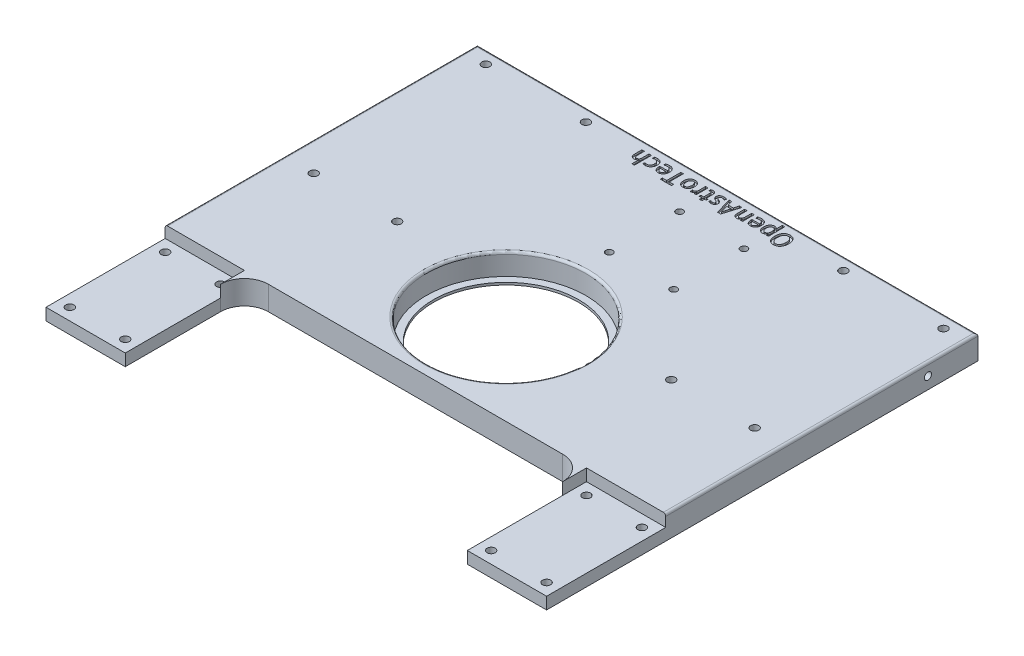
from build123d import *

# Parameters (mm, degrees)
SKIZZE1_W                        = 210
SKIZZE1_H                        = 420
AUFSATZ_LINEAR_AUSTRAGEN1_DEPTH  = 10
SKIZZE5_W                        = 210
SKIZZE5_H                        = 85
SCHNITT_LINEAR_AUSTRAGEN2_DEPTH  = 10
SKIZZE6_R                        = 1.7
SCHNITT_LINEAR_AUSTRAGEN3_DEPTH  = 236
SCHNITT_LINEAR_AUSTRAGEN4_DEPTH  = 4
SKIZZE16_W                       = 35
SKIZZE16_H                       = 7
SCHNITT_LINEAR_AUSTRAGEN10_DEPTH = 5
SCHNITT_LINEAR_AUSTRAGEN11_DEPTH = 35
SKIZZE20_R                       = 1.7
SCHNITT_LINEAR_AUSTRAGEN12_DEPTH = 236
SKIZZE21_W                       = 143.493506494
SKIZZE21_H                       = 50
SCHNITT_LINEAR_AUSTRAGEN13_DEPTH = 236
SCHNITT_LINEAR_AUSTRAGEN14_DEPTH = 236
AUFSATZ_LINEAR_AUSTRAGEN6_DEPTH  = 10
SKIZZE25_R                       = 1.7
SCHNITT_LINEAR_AUSTRAGEN15_DEPTH = 236
SCHNITT_LINEAR_AUSTRAGEN16_DEPTH = 298.153159162
SKIZZE27_R                       = 33.5
SCHNITT_LINEAR_AUSTRAGEN17_DEPTH = 164.554272338
SKIZZE28_R                       = 36.006256149
SKIZZE28_R_2                     = 30.5
AUFSATZ_LINEAR_AUSTRAGEN7_DEPTH  = 1
SKIZZE29_R                       = 1.5
SCHNITT_LINEAR_AUSTRAGEN18_DEPTH = 10
SKIZZE30_R                       = 1.5
SCHNITT_LINEAR_AUSTRAGEN19_DEPTH = 10
SKIZZE31_R                       = 2.95
SCHNITT_LINEAR_AUSTRAGEN20_DEPTH = 3.5
SCHNITT_LINEAR_AUSTRAGEN21_DEPTH = 164.554272338
VERRUNDUNG1_R                    = 10
AUFSATZ_LINEAR_AUSTRAGEN8_DEPTH  = 5
VERRUNDUNG2_R                    = 1
SCHNITT_LINEAR_AUSTRAGEN22_DEPTH = 0.8


with BuildPart() as part:
    # Skizze1 → Aufsatz-Linear austragen1 (new body)
    with BuildSketch(Plane(origin=(0, 0, 0), x_dir=(1, 0, 0), z_dir=(0, 1, 0))):
        Rectangle(SKIZZE1_W, SKIZZE1_H)
    extrude(amount=AUFSATZ_LINEAR_AUSTRAGEN1_DEPTH)

    # Skizze5 → Schnitt-Linear austragen2 (cut)
    with BuildSketch(Plane(origin=(0, 10, 0), x_dir=(1, 0, 0), z_dir=(0, 1, 0))):
        Polygon((105, -210), (18, -210), (105, -56), align=None)
        Polygon((-18, -210), (-105, -56), (-105, -210), align=None)
        with Locations((0, 167.5)):
            Rectangle(SKIZZE5_W, SKIZZE5_H)
        Polygon((71.746753247, -56), (-71.746753247, -56), (-2.824675325, -178), (2.824675325, -178), align=None)
    extrude(amount=-SCHNITT_LINEAR_AUSTRAGEN2_DEPTH, mode=Mode.SUBTRACT)

    # Skizze6 → Schnitt-Linear austragen3 (cut, through all)
    with BuildSketch(Plane(origin=(0, 10, 0), x_dir=(1, 0, 0), z_dir=(0, 1, 0))):
        with Locations(Location((-11, -205, 0), (0, 0, 270))):
            Circle(SKIZZE6_R)
        with Locations(Location((-11, -188.18, 0), (0, 0, 90))):
            Circle(SKIZZE6_R)
        with Locations(Location((11, -205, 0), (0, 0, 90))):
            Circle(SKIZZE6_R)
        with Locations(Location((11, -188.18, 0), (0, 0, 270))):
            Circle(SKIZZE6_R)
    extrude(amount=-SCHNITT_LINEAR_AUSTRAGEN3_DEPTH, mode=Mode.SUBTRACT)

    # Skizze7 → Schnitt-Linear austragen4 (cut)
    with BuildSketch(Plane.XZ):
        Polygon((-11, 208.406366588), (-8.05, 206.703183294), (-8.05, 203.296816706), (-11, 201.593633412), (-13.95, 203.296816706), (-13.95, 206.703183294), align=None)
        Polygon((11, 208.406366588), (8.05, 206.703183294), (8.05, 203.296816706), (11, 201.593633412), (13.95, 203.296816706), (13.95, 206.703183294), align=None)
        Polygon((-8.05, 186.476816706), (-8.05, 189.883183294), (-11, 191.586366588), (-13.95, 189.883183294), (-13.95, 186.476816706), (-11, 184.773633412), align=None)
        Polygon((8.05, 186.476816706), (8.05, 189.883183294), (11, 191.586366588), (13.95, 189.883183294), (13.95, 186.476816706), (11, 184.773633412), align=None)
    extrude(amount=-SCHNITT_LINEAR_AUSTRAGEN4_DEPTH, mode=Mode.SUBTRACT)

    # Skizze16 → Schnitt-Linear austragen10 (cut)
    with BuildSketch(Plane.XZ):
        with Locations((0, 196.59)):
            Rectangle(SKIZZE16_W, SKIZZE16_H)
    extrude(amount=-SCHNITT_LINEAR_AUSTRAGEN10_DEPTH, mode=Mode.SUBTRACT)

    # Skizze17 → Schnitt-Linear austragen11 (cut)
    with BuildSketch(Plane.ZY.offset(-17.5)):
        Polygon((193.09, 5), (196.59, 8.5), (200.09, 5), align=None)
    extrude(amount=SCHNITT_LINEAR_AUSTRAGEN11_DEPTH, mode=Mode.SUBTRACT)

    # Skizze20 → Schnitt-Linear austragen12 (cut, through all)
    with BuildSketch(Plane(origin=(0, 10, 0), x_dir=(1, 0, 0), z_dir=(0, 1, 0))):
        with Locations(Location((96, 119.52, 0), (0, 0, 270))):
            Circle(SKIZZE20_R)
        with Locations(Location((54, 119.52, 0), (0, 0, 270))):
            Circle(SKIZZE20_R)
        with Locations(Location((-54, 119.52, 0), (0, 0, 90))):
            Circle(SKIZZE20_R)
        with Locations(Location((-96, 119.52, 0), (0, 0, 90))):
            Circle(SKIZZE20_R)
        with Locations(Location((92.5, 43.82, 0), (0, 0, 270))):
            Circle(SKIZZE20_R)
        with Locations(Location((57.5, 43.82, 0), (0, 0, 270))):
            Circle(SKIZZE20_R)
        with Locations(Location((-92.5, 43.82, 0), (0, 0, 90))):
            Circle(SKIZZE20_R)
        with Locations(Location((-57.5, 43.82, 0), (0, 0, 90))):
            Circle(SKIZZE20_R)
    extrude(amount=-SCHNITT_LINEAR_AUSTRAGEN12_DEPTH, mode=Mode.SUBTRACT)

    # Skizze21 → Schnitt-Linear austragen13 (cut, through all)
    with BuildSketch(Plane(origin=(0, 10, 0), x_dir=(1, 0, 0), z_dir=(0, 1, 0))):
        with Locations((0, -31)):
            Rectangle(SKIZZE21_W, SKIZZE21_H)
    extrude(amount=-SCHNITT_LINEAR_AUSTRAGEN13_DEPTH, mode=Mode.SUBTRACT)

    # Skizze22 → Schnitt-Linear austragen14 (cut, through all)
    with BuildSketch(Plane(origin=(0, 10, 0), x_dir=(1, 0, 0), z_dir=(0, 1, 0))):
        with BuildLine():
            Line((-71.746753247, -56), (-2.824675325, -178))
            ThreePointArc((-2.824675325, -178), (-55.506711033, -127.293679981), (-71.746753247, -56))
        make_face()
    schnitt_linear_austragen14 = extrude(amount=-SCHNITT_LINEAR_AUSTRAGEN14_DEPTH, mode=Mode.SUBTRACT)

    # Skizze23 → Aufsatz-Linear austragen6 (add)
    with BuildSketch(Plane(origin=(0, 10, 0), x_dir=(1, 0, 0), z_dir=(0, 1, 0))):
        with BuildLine():
            Line((-105, -56), (-18, -210))
            ThreePointArc((-18, -210), (-78.088357737, -142.371344955), (-105, -56))
        make_face()
    aufsatz_linear_austragen6 = extrude(amount=-AUFSATZ_LINEAR_AUSTRAGEN6_DEPTH)

    # Spiegeln2: Schnitt-Linear austragen14, Aufsatz-Linear austragen6 across plane
    add(schnitt_linear_austragen14.mirror(Plane(origin=(0, 0, 0), x_dir=(0, 0, 1), z_dir=(1, 0, 0))), mode=Mode.SUBTRACT)
    add(aufsatz_linear_austragen6.mirror(Plane(origin=(0, 0, 0), x_dir=(0, 0, 1), z_dir=(1, 0, 0))))

    # Skizze25 → Schnitt-Linear austragen15 (cut, through all)
    with BuildSketch(Plane(origin=(0, 10, 0), x_dir=(1, 0, 0), z_dir=(0, 1, 0))):
        with Locations(Location((-100, -11, 0), (0, 0, 270))):
            Circle(SKIZZE25_R)
        with Locations(Location((-76.746753247, -11, 0), (0, 0, 90))):
            Circle(SKIZZE25_R)
        with Locations(Location((-76.746753247, -51, 0), (0, 0, 270))):
            Circle(SKIZZE25_R)
        with Locations(Location((-100, -51, 0), (0, 0, 90))):
            Circle(SKIZZE25_R)
    schnitt_linear_austragen15 = extrude(amount=-SCHNITT_LINEAR_AUSTRAGEN15_DEPTH, mode=Mode.SUBTRACT)

    # Spiegeln3: Schnitt-Linear austragen15 across plane
    add(schnitt_linear_austragen15.mirror(Plane(origin=(0, 0, 0), x_dir=(0, 0, 1), z_dir=(1, 0, 0))), mode=Mode.SUBTRACT)

    # Skizze26 → Schnitt-Linear austragen16 (cut, through all)
    with BuildSketch(Plane.ZY.offset(105)):
        Polygon((6, 5), (6, 13.101486595), (200.684563047, 82.546277137), (242.997216492, -41.037631402), (91.241487897, -60.284782055), (56, 0), (56, 5), align=None)
    extrude(amount=-SCHNITT_LINEAR_AUSTRAGEN16_DEPTH, mode=Mode.SUBTRACT)

    # Skizze27 → Schnitt-Linear austragen17 (cut, through all)
    with BuildSketch(Plane(origin=(0, 10, 0), x_dir=(1, 0, 0), z_dir=(0, 1, 0))):
        with Locations(Location((0, 32, 0), (0, 0, 270))):
            Circle(SKIZZE27_R)
    extrude(amount=-SCHNITT_LINEAR_AUSTRAGEN17_DEPTH, mode=Mode.SUBTRACT)

    # Skizze28 → Aufsatz-Linear austragen7 (add)
    with BuildSketch(Plane.XZ):
        with Locations((0, -32)):
            Circle(SKIZZE28_R)
        with Locations(Location((0, -32, 0), (0, 0, 270))):
            Circle(SKIZZE28_R_2, mode=Mode.SUBTRACT)
    extrude(amount=-AUFSATZ_LINEAR_AUSTRAGEN7_DEPTH)

    # Skizze29 → Schnitt-Linear austragen18 (cut)
    with BuildSketch(Plane.ZY.offset(105)):
        with Locations((-104, 5)):
            Circle(SKIZZE29_R)
    schnitt_linear_austragen18 = extrude(amount=-SCHNITT_LINEAR_AUSTRAGEN18_DEPTH, mode=Mode.SUBTRACT)

    # Skizze30 → Schnitt-Linear austragen19 (cut)
    with BuildSketch(Plane(origin=(0, 0, -125), x_dir=(-1, 0, 0), z_dir=(0, 0, -1))):
        with Locations((100, 5)):
            Circle(SKIZZE30_R)
        with Locations((84, 5)):
            Circle(SKIZZE30_R)
    schnitt_linear_austragen19 = extrude(amount=-SCHNITT_LINEAR_AUSTRAGEN19_DEPTH, mode=Mode.SUBTRACT)

    # Spiegeln4: Schnitt-Linear austragen18, Schnitt-Linear austragen19 across plane
    add(schnitt_linear_austragen18.mirror(Plane(origin=(0, 0, 0), x_dir=(0, 0, 1), z_dir=(1, 0, 0))), mode=Mode.SUBTRACT)
    add(schnitt_linear_austragen19.mirror(Plane(origin=(0, 0, 0), x_dir=(0, 0, 1), z_dir=(1, 0, 0))), mode=Mode.SUBTRACT)

    # Skizze31 → Schnitt-Linear austragen20 (cut)
    with BuildSketch(Plane.XZ):
        with Locations(Location((-96, -119.52, 0), (0, 0, 270))):
            Circle(SKIZZE31_R)
        with Locations(Location((-54, -119.52, 0), (0, 0, 270))):
            Circle(SKIZZE31_R)
        with Locations(Location((-92.5, -43.82, 0), (0, 0, 270))):
            Circle(SKIZZE31_R)
        with Locations(Location((-57.5, -43.82, 0), (0, 0, 270))):
            Circle(SKIZZE31_R)
        with Locations(Location((57.5, -43.82, 0), (0, 0, 90))):
            Circle(SKIZZE31_R)
        with Locations(Location((92.5, -43.82, 0), (0, 0, 90))):
            Circle(SKIZZE31_R)
        with Locations(Location((54, -119.52, 0), (0, 0, 90))):
            Circle(SKIZZE31_R)
        with Locations(Location((96, -119.52, 0), (0, 0, 90))):
            Circle(SKIZZE31_R)
    extrude(amount=-SCHNITT_LINEAR_AUSTRAGEN20_DEPTH, mode=Mode.SUBTRACT)

    # Skizze32 → Schnitt-Linear austragen21 (cut, through all)
    with BuildSketch(Plane(origin=(0, 10, 0), x_dir=(1, 0, 0), z_dir=(0, 1, 0))):
        with BuildLine():
            ThreePointArc((26.611267379, 77.141035841), (26.186572211, 78.166340673), (25.161267379, 78.591035841))
            Line((25.161267379, 78.591035841), (25.161267379, 77.141035841))
            Line((25.161267379, 77.141035841), (23.711267379, 77.141035841))
            ThreePointArc((23.711267379, 77.141035841), (25.161267379, 75.691035841), (26.611267379, 77.141035841))
        make_face()
        with BuildLine():
            Line((25.161267379, 77.141035841), (25.161267379, 78.591035841))
            ThreePointArc((25.161267379, 78.591035841), (24.135962546, 78.166340673), (23.711267379, 77.141035841))
            Line((23.711267379, 77.141035841), (25.161267379, 77.141035841))
        make_face()
        with BuildLine():
            ThreePointArc((26.611267379, 77.141035841), (26.186572211, 78.166340673), (25.161267379, 78.591035841))
            Line((25.161267379, 78.591035841), (25.161267379, 77.141035841))
            Line((25.161267379, 77.141035841), (23.711267379, 77.141035841))
            ThreePointArc((23.711267379, 77.141035841), (25.161267379, 75.691035841), (26.611267379, 77.141035841))
        make_face()
        with BuildLine():
            Line((25.161267379, 77.141035841), (25.161267379, 78.591035841))
            ThreePointArc((25.161267379, 78.591035841), (24.135962546, 78.166340673), (23.711267379, 77.141035841))
            Line((23.711267379, 77.141035841), (25.161267379, 77.141035841))
        make_face()
        with BuildLine():
            ThreePointArc((-0.388732621, 77.141035841), (-0.813427789, 78.166340673), (-1.838732621, 78.591035841))
            Line((-1.838732621, 78.591035841), (-1.838732621, 77.141035841))
            Line((-1.838732621, 77.141035841), (-0.388732621, 77.141035841))
        make_face()
        with BuildLine():
            Line((-1.838732621, 77.141035841), (-1.838732621, 78.591035841))
            ThreePointArc((-1.838732621, 78.591035841), (-2.864037454, 76.115731008), (-0.388732621, 77.141035841))
            Line((-0.388732621, 77.141035841), (-1.838732621, 77.141035841))
        make_face()
        with BuildLine():
            ThreePointArc((-0.388732621, 77.141035841), (-0.813427789, 78.166340673), (-1.838732621, 78.591035841))
            Line((-1.838732621, 78.591035841), (-1.838732621, 77.141035841))
            Line((-1.838732621, 77.141035841), (-0.388732621, 77.141035841))
        make_face()
        with BuildLine():
            Line((-1.838732621, 77.141035841), (-1.838732621, 78.591035841))
            ThreePointArc((-1.838732621, 78.591035841), (-2.864037454, 76.115731008), (-0.388732621, 77.141035841))
            Line((-0.388732621, 77.141035841), (-1.838732621, 77.141035841))
        make_face()
        with BuildLine():
            ThreePointArc((-1.838732621, 105.191035841), (-0.813427789, 105.615731008), (-0.388732621, 106.641035841))
            Line((-0.388732621, 106.641035841), (-1.838732621, 106.641035841))
            Line((-1.838732621, 106.641035841), (-1.838732621, 105.191035841))
        make_face()
        with BuildLine():
            Line((-1.838732621, 106.641035841), (-0.388732621, 106.641035841))
            ThreePointArc((-0.388732621, 106.641035841), (-2.864037454, 107.666340673), (-1.838732621, 105.191035841))
            Line((-1.838732621, 105.191035841), (-1.838732621, 106.641035841))
        make_face()
        with BuildLine():
            ThreePointArc((-1.838732621, 105.191035841), (-0.813427789, 105.615731008), (-0.388732621, 106.641035841))
            Line((-0.388732621, 106.641035841), (-1.838732621, 106.641035841))
            Line((-1.838732621, 106.641035841), (-1.838732621, 105.191035841))
        make_face()
        with BuildLine():
            Line((-1.838732621, 106.641035841), (-0.388732621, 106.641035841))
            ThreePointArc((-0.388732621, 106.641035841), (-2.864037454, 107.666340673), (-1.838732621, 105.191035841))
            Line((-1.838732621, 105.191035841), (-1.838732621, 106.641035841))
        make_face()
        with BuildLine():
            ThreePointArc((26.611267379, 106.641035841), (25.161267379, 108.091035841), (23.711267379, 106.641035841))
            Line((23.711267379, 106.641035841), (25.161267379, 106.641035841))
            Line((25.161267379, 106.641035841), (25.161267379, 105.191035841))
            ThreePointArc((25.161267379, 105.191035841), (26.186572211, 105.615731008), (26.611267379, 106.641035841))
        make_face()
        with BuildLine():
            Line((25.161267379, 106.641035841), (23.711267379, 106.641035841))
            ThreePointArc((23.711267379, 106.641035841), (24.135962546, 105.615731008), (25.161267379, 105.191035841))
            Line((25.161267379, 105.191035841), (25.161267379, 106.641035841))
        make_face()
        with BuildLine():
            ThreePointArc((26.611267379, 106.641035841), (25.161267379, 108.091035841), (23.711267379, 106.641035841))
            Line((23.711267379, 106.641035841), (25.161267379, 106.641035841))
            Line((25.161267379, 106.641035841), (25.161267379, 105.191035841))
            ThreePointArc((25.161267379, 105.191035841), (26.186572211, 105.615731008), (26.611267379, 106.641035841))
        make_face()
        with BuildLine():
            Line((25.161267379, 106.641035841), (23.711267379, 106.641035841))
            ThreePointArc((23.711267379, 106.641035841), (24.135962546, 105.615731008), (25.161267379, 105.191035841))
            Line((25.161267379, 105.191035841), (25.161267379, 106.641035841))
        make_face()
    extrude(amount=-SCHNITT_LINEAR_AUSTRAGEN21_DEPTH, mode=Mode.SUBTRACT)

    # Verrundung1
    verrundung1_edges = [part.edges().sort_by_distance(p)[0] for p in [
        (-71.746753247, 2.5, 6),
        (71.746753247, 2.5, 6),
    ]]
    fillet(verrundung1_edges, radius=VERRUNDUNG1_R)

    # Skizze33 → Aufsatz-Linear austragen8 (add)
    with BuildSketch(Plane(origin=(0, 5, 0), x_dir=(1, 0, 0), z_dir=(0, 1, 0))):
        with BuildLine():
            Line((-71.746753247, -16), (-71.746753247, -6))
            Line((-71.746753247, -6), (-61.746753247, -6))
            ThreePointArc((-61.746753247, -6), (-68.817821059, -8.928932188), (-71.746753247, -16))
        make_face()
        with BuildLine():
            Line((71.746753247, -6), (61.746753247, -6))
            ThreePointArc((61.746753247, -6), (68.817821059, -8.928932188), (71.746753247, -16))
            Line((71.746753247, -16), (71.746753247, -6))
        make_face()
    extrude(amount=AUFSATZ_LINEAR_AUSTRAGEN8_DEPTH)

    # Verrundung2
    verrundung2_edges = [part.edges().sort_by_distance(p)[0] for p in [
        (-105, 10, -59.5),
        (105, 10, -59.5),
        (0, 10, -65.5),
        (0, 10, -125),
    ]]
    fillet(verrundung2_edges, radius=VERRUNDUNG2_R)

    # Skizze34 → Schnitt-Linear austragen22 (cut)
    # profile 1 of 13: a face of its own
    with BuildSketch(Plane(origin=(0, 10, 0), x_dir=(1, 0, 0), z_dir=(0, 1, 0))):
        with BuildLine():
            add(Edge.make_bspline(
                [(29.85070191, 114.288911252), (29.959911613, 114.2929201), (30.173598401, 114.300764073), (30.48499412, 114.349995943), (30.779650983, 114.425042199), (31.056164233, 114.531720195), (31.315421754, 114.666728747), (31.556464113, 114.831670454), (31.779682791, 115.025389194), (31.983756179, 115.246724084), (32.166631051, 115.493608298), (32.327914127, 115.763430462), (32.462509631, 116.056519147), (32.575577092, 116.370213432), (32.662473654, 116.706087016), (32.726835778, 117.06322522), (32.76694588, 117.442436478), (32.774446181, 117.702626513), (32.778293275, 117.836084536)],
                knots=[0, 0, 0, 0, 1.012987315, 1.982076671, 2.918070024, 3.828909042, 4.724975956, 5.623775762, 6.531918119, 7.461037708, 8.410838949, 9.377221151, 10.371713025, 11.397981656, 12.466609933, 13.585978424, 14.761787533, 16, 16, 16, 16], degree=3))
            add(Edge.make_bspline(
                [(32.778293275, 117.836084536), (32.775321146, 117.964378272), (32.769513644, 118.215062671), (32.731464831, 118.580778779), (32.671661892, 118.926500047), (32.587580559, 119.251409464), (32.482227657, 119.556298433), (32.352914557, 119.840410252), (32.199816042, 120.104101372), (32.024709744, 120.34620291), (31.830202269, 120.565736667), (31.614608781, 120.75648833), (31.380775114, 120.919068321), (31.128249789, 121.053085575), (30.856880414, 121.157702032), (30.567286493, 121.233440063), (30.259802799, 121.282186374), (30.048457931, 121.290565621), (29.940295523, 121.294853965)],
                knots=[0, 0, 0, 0, 1.222503048, 2.388756074, 3.500169846, 4.563104703, 5.583468788, 6.570443324, 7.533038822, 8.484279774, 9.413372322, 10.322376827, 11.220780875, 12.121240343, 13.040147159, 13.98580634, 14.969172806, 16, 16, 16, 16], degree=3))
            add(Edge.make_bspline(
                [(29.940295523, 121.294853965), (29.835619445, 121.292655783), (29.630144854, 121.288340846), (29.329534393, 121.246120331), (29.044126508, 121.17652392), (28.774000206, 121.079438077), (28.518933666, 120.954631676), (28.278784135, 120.801719155), (28.055027143, 120.618987351), (27.844672014, 120.411770984), (27.656220129, 120.174173045), (27.489236714, 119.909231718), (27.350887969, 119.613675955), (27.234761011, 119.291397483), (27.143332961, 118.94059788), (27.07752364, 118.562020825), (27.034271005, 118.15495631), (27.02636499, 117.874054323), (27.022281463, 117.72896593)],
                knots=[0, 0, 0, 0, 0.964497264, 1.893266228, 2.791633031, 3.66849831, 4.534017508, 5.404221222, 6.286807308, 7.19257516, 8.120979983, 9.076063375, 10.07298676, 11.122987012, 12.230146749, 13.410274263, 14.662383454, 16, 16, 16, 16], degree=3))
            add(Edge.make_bspline(
                [(27.022281463, 117.72896593), (27.024421524, 117.605418086), (27.028606181, 117.363833781), (27.063913892, 117.010518295), (27.122191425, 116.675597892), (27.200200108, 116.357559889), (27.302067792, 116.057241679), (27.427545846, 115.774794814), (27.57567298, 115.51026228), (27.74317652, 115.263460185), (27.934682277, 115.040607579), (28.146859965, 114.844660764), (28.379979279, 114.677078508), (28.635261514, 114.542250695), (28.909492062, 114.432030235), (29.205331829, 114.354925267), (29.520856407, 114.303276888), (29.738327366, 114.2933567), (29.85070191, 114.288911252)],
                knots=[0, 0, 0, 0, 1.181997023, 2.311265979, 3.393394717, 4.432710499, 5.441572568, 6.423779709, 7.385757606, 8.339154063, 9.273212536, 10.190881701, 11.096730823, 12.012033381, 12.946898792, 13.918455472, 14.931549697, 16, 16, 16, 16], degree=3))
        make_face()
        with BuildLine():
            add(Edge.make_bspline(
                [(29.886853431, 115.10069212), (29.811948825, 115.106475079), (29.665888764, 115.117751547), (29.454784173, 115.163617685), (29.258439386, 115.232614204), (29.078726615, 115.328719724), (28.913049212, 115.445707531), (28.76198569, 115.58639357), (28.627315967, 115.751836169), (28.510396113, 115.939251222), (28.407073457, 116.14069557), (28.31720149, 116.351522688), (28.238505992, 116.568619023), (28.177639287, 116.794272553), (28.1275986, 117.026267656), (28.095259166, 117.266221578), (28.073409113, 117.513029683), (28.071304092, 117.680304353), (28.070236976, 117.765102327)],
                knots=[0, 0, 0, 0, 1.004441371, 1.958608082, 2.88184463, 3.780632764, 4.676761865, 5.589219383, 6.534241407, 7.522869299, 8.539936667, 9.561215444, 10.588238561, 11.627388882, 12.686505249, 13.762033373, 14.865488509, 16, 16, 16, 16], degree=3))
            add(Edge.make_bspline(
                [(28.070236976, 117.765102327), (28.071893818, 117.857630122), (28.075142307, 118.039044858), (28.095645827, 118.305876463), (28.131219527, 118.561641176), (28.183635441, 118.806177984), (28.247510213, 119.04014658), (28.325927076, 119.263167438), (28.42112079, 119.474074428), (28.527705051, 119.673424706), (28.649803199, 119.855936983), (28.786439566, 120.016938109), (28.938221544, 120.154589977), (29.103792046, 120.26876565), (29.284199066, 120.358888337), (29.478459813, 120.424115176), (29.686213639, 120.469764477), (29.830352002, 120.478567807), (29.904159126, 120.483075618)],
                knots=[0, 0, 0, 0, 1.215168902, 2.3825224, 3.512302654, 4.603757503, 5.664662392, 6.695722199, 7.704767967, 8.700807624, 9.661364617, 10.583018582, 11.467001179, 12.34458741, 13.216279754, 14.10603896, 15.030183138, 16, 16, 16, 16], degree=3))
            add(Edge.make_bspline(
                [(29.904159126, 120.483075618), (29.97708293, 120.477980293), (30.119434233, 120.468033938), (30.325056433, 120.42335331), (30.516463719, 120.355639024), (30.695564845, 120.266291613), (30.860359686, 120.151635057), (31.010697031, 120.013488501), (31.147747809, 119.85277378), (31.268191351, 119.669917119), (31.375817945, 119.471641538), (31.469994117, 119.262290436), (31.550219911, 119.043215336), (31.616308515, 118.81475017), (31.665676677, 118.576374171), (31.703786032, 118.329665369), (31.725697464, 118.073088689), (31.728772363, 117.8989334), (31.730337761, 117.810272823)],
                knots=[0, 0, 0, 0, 0.974094497, 1.901486386, 2.796224591, 3.676437371, 4.563042432, 5.464727423, 6.392722701, 7.373084354, 8.37967889, 9.39929017, 10.432248303, 11.489232847, 12.568520497, 13.677080387, 14.817426717, 16, 16, 16, 16], degree=3))
            add(Edge.make_bspline(
                [(31.730337761, 117.810272823), (31.729046937, 117.723777577), (31.726494108, 117.552718229), (31.707777075, 117.299978958), (31.671771217, 117.055058327), (31.625545207, 116.817442726), (31.561015772, 116.588608699), (31.485521173, 116.366416102), (31.393288182, 116.153045643), (31.29041418, 115.947974489), (31.17226193, 115.758490046), (31.035561719, 115.591125987), (30.882642568, 115.448425299), (30.713949768, 115.329033407), (30.529048865, 115.234571972), (30.328721813, 115.163359315), (30.112684402, 115.116011087), (29.962903831, 115.105456051), (29.886090927, 115.100043046)],
                knots=[0, 0, 0, 0, 1.136615237, 2.247853704, 3.32712805, 4.38811145, 5.426335915, 6.448929369, 7.469567769, 8.478317094, 9.461655943, 10.397556452, 11.309504531, 12.201935297, 13.104531622, 14.028957108, 14.989177776, 16, 16, 16, 16], degree=3))
            Line((29.886090927, 115.100043046), (29.886853431, 115.10069212))
        make_face(mode=Mode.SUBTRACT)
    # profile 2 of 13: a face of its own
    with BuildSketch(Plane(origin=(0, 10, 0), x_dir=(1, 0, 0), z_dir=(0, 1, 0))):
        with BuildLine():
            Line((24.817961244, 117.027206225), (24.872165839, 116.293375971))
            Line((24.872165839, 116.293375971), (25.793191503, 116.293375971))
            add(Edge.make_bspline(
                [(25.793191503, 116.293375971), (25.790144741, 116.346864194), (25.783841774, 116.457517604), (25.777787661, 116.628933187), (25.772999215, 116.810498747), (25.767394898, 117.002345533), (25.763621594, 117.204116832), (25.761466156, 117.416644985), (25.758393683, 117.639047942), (25.757806813, 117.790912903), (25.757507567, 117.868349176)],
                knots=[0, 0, 0, 0, 0.816080132, 1.688260417, 2.612621697, 3.582837222, 4.611864457, 5.686655616, 6.820420674, 8, 8, 8, 8], degree=3))
            Line((25.757507567, 117.868349176), (25.757508827, 123.186682321))
            Line((25.757508827, 123.186682321), (24.709552053, 123.186682321))
            Line((24.709552053, 123.186682321), (24.709552053, 120.624905179))
            Line((24.709552053, 120.624905179), (24.691747265, 120.624905179))
            add(Edge.make_bspline(
                [(24.691747265, 120.624905179), (24.659504168, 120.673784233), (24.594691339, 120.772037505), (24.47119197, 120.900594938), (24.33052588, 121.016046863), (24.170193155, 121.112888261), (23.995057427, 121.194078733), (23.804404343, 121.249603884), (23.601996633, 121.287576538), (23.462168407, 121.292389588), (23.390573561, 121.294853965)],
                knots=[0, 0, 0, 0, 0.917555489, 1.844406173, 2.785224624, 3.767404775, 4.776790174, 5.806572874, 6.876921489, 8, 8, 8, 8], degree=3))
            add(Edge.make_bspline(
                [(23.390573561, 121.294853965), (23.324653475, 121.293753297), (23.193890548, 121.291569947), (23.000773749, 121.262269691), (22.813637928, 121.212766951), (22.63206235, 121.143833619), (22.45566722, 121.055895448), (22.285743104, 120.946690969), (22.1231915, 120.816086493), (21.965301151, 120.669054684), (21.819665279, 120.499134744), (21.691692623, 120.305954678), (21.583052996, 120.089477081), (21.493331567, 119.850934457), (21.420865103, 119.590558917), (21.369558378, 119.307499695), (21.332220318, 119.002832971), (21.324472077, 118.791664507), (21.320474246, 118.682708694)],
                knots=[0, 0, 0, 0, 0.846490182, 1.679147299, 2.502484195, 3.330060495, 4.17066308, 5.030977055, 5.920271087, 6.847142536, 7.799964117, 8.788939239, 9.817453113, 10.905797346, 12.05931981, 13.285633072, 14.599478126, 16, 16, 16, 16], degree=3))
            add(Edge.make_bspline(
                [(21.320474246, 118.682708694), (21.323533875, 118.588413457), (21.329484865, 118.405008882), (21.358842788, 118.137835558), (21.400722504, 117.885743647), (21.464468876, 117.650021074), (21.538590487, 117.428109649), (21.634068321, 117.223481662), (21.743760628, 117.033932756), (21.868795484, 116.860988018), (22.007013452, 116.706031393), (22.155080649, 116.569705012), (22.314352874, 116.454907822), (22.482639523, 116.360851178), (22.659955491, 116.284251892), (22.847825341, 116.230859418), (23.045166036, 116.196179074), (23.180062398, 116.190760254), (23.248609144, 116.188006714)],
                knots=[0, 0, 0, 0, 1.284748414, 2.49884027, 3.658844163, 4.761893676, 5.821980921, 6.841963681, 7.832011751, 8.801448359, 9.743649362, 10.656243259, 11.537788843, 12.411527703, 13.277984211, 14.162660369, 15.066367302, 16, 16, 16, 16], degree=3))
            add(Edge.make_bspline(
                [(23.248609144, 116.188006714), (23.332250648, 116.191171041), (23.494987842, 116.197327719), (23.730753165, 116.239663009), (23.950815609, 116.306514648), (24.154754837, 116.400012421), (24.342373702, 116.518398648), (24.513499814, 116.662370906), (24.668170841, 116.832406969), (24.755400278, 116.961196302), (24.799893045, 117.026887359)],
                knots=[0, 0, 0, 0, 1.087119714, 2.115155793, 3.104108699, 4.070148142, 5.022884304, 5.979617794, 6.969471783, 8, 8, 8, 8], degree=3))
            Line((24.799893045, 117.026887359), (24.817961244, 117.027206225))
        make_face()
        with BuildLine():
            add(Edge.make_bspline(
                [(24.709552053, 118.307728038), (24.707751143, 118.261874422), (24.704227908, 118.172168104), (24.685851832, 118.041113184), (24.657187318, 117.91649848), (24.619603241, 117.797413103), (24.573914701, 117.683614742), (24.516160741, 117.576701116), (24.448615827, 117.476063326), (24.373343659, 117.38086395), (24.290042782, 117.295123251), (24.201629816, 117.219900898), (24.109870106, 117.154277486), (24.012045507, 117.101446004), (23.909843961, 117.058093936), (23.802180778, 117.027902679), (23.690813414, 117.006116342), (23.614807618, 117.001909761), (23.576417889, 116.999785061)],
                knots=[0, 0, 0, 0, 1.14962799, 2.249089649, 3.311058881, 4.351180817, 5.376384794, 6.379810015, 7.390623649, 8.411110361, 9.417659183, 10.381366364, 11.317721371, 12.239371103, 13.162533389, 14.094158043, 15.037379231, 16, 16, 16, 16], degree=3))
            add(Edge.make_bspline(
                [(23.576417889, 116.999785061), (23.528527475, 117.002467468), (23.434589281, 117.007729072), (23.299076901, 117.035598538), (23.172026979, 117.076468056), (23.055017422, 117.134502793), (22.945853132, 117.205061257), (22.847195306, 117.292153912), (22.755562149, 117.391456807), (22.677337946, 117.507495287), (22.604759001, 117.631683064), (22.543210956, 117.765579126), (22.489770937, 117.906372651), (22.447855267, 118.055133733), (22.414143732, 118.210713189), (22.389519156, 118.373604972), (22.375521598, 118.543939053), (22.373387023, 118.659883327), (22.372301517, 118.718845091)],
                knots=[0, 0, 0, 0, 0.981281094, 1.924806366, 2.824826389, 3.707556406, 4.592263226, 5.479205099, 6.396146844, 7.351895143, 8.338817304, 9.34011022, 10.366256886, 11.420469175, 12.502377923, 13.625172906, 14.792316403, 16, 16, 16, 16], degree=3))
            add(Edge.make_bspline(
                [(22.372301517, 118.718845091), (22.373204163, 118.78255097), (22.374963482, 118.906718055), (22.391206862, 119.088076651), (22.415242835, 119.260577124), (22.449360137, 119.423841093), (22.495383212, 119.577519188), (22.549314331, 119.722140552), (22.612051812, 119.858313385), (22.68588169, 119.983392227), (22.767729162, 120.098056831), (22.861376777, 120.197318118), (22.962290013, 120.283844503), (23.073072266, 120.354316852), (23.193452975, 120.408291203), (23.321314287, 120.44997731), (23.458785032, 120.476493752), (23.553497742, 120.480839586), (23.602229601, 120.483075618)],
                knots=[0, 0, 0, 0, 1.269292117, 2.473936553, 3.625744077, 4.738870092, 5.794066467, 6.819554918, 7.812933128, 8.777481147, 9.710342625, 10.614110635, 11.490085324, 12.353424998, 13.220460075, 14.11244037, 15.02880731, 16, 16, 16, 16], degree=3))
            add(Edge.make_bspline(
                [(23.602229601, 120.483075618), (23.63539051, 120.482412648), (23.701112143, 120.481098708), (23.798973485, 120.46804585), (23.894670928, 120.444202344), (23.989329722, 120.412496148), (24.081175992, 120.368785923), (24.172095825, 120.317651743), (24.259673888, 120.254557141), (24.346266973, 120.184350345), (24.427762196, 120.104192316), (24.498534297, 120.010494625), (24.558029323, 119.90580504), (24.611415971, 119.791252032), (24.649749006, 119.664033087), (24.681246148, 119.526604585), (24.701826427, 119.377599958), (24.706919283, 119.274289565), (24.709552053, 119.220882893)],
                knots=[0, 0, 0, 0, 0.847190485, 1.679047567, 2.516335765, 3.364666864, 4.225444966, 5.111820278, 6.026912602, 6.979920651, 7.959447896, 8.940146714, 9.969728307, 11.03246919, 12.162514152, 13.35738975, 14.633893301, 16, 16, 16, 16], degree=3))
            Line((24.709552053, 119.220882893), (24.709552053, 118.307728038))
        make_face(mode=Mode.SUBTRACT)
    # profile 3 of 13: a face of its own
    with BuildSketch(Plane(origin=(0, 10, 0), x_dir=(1, 0, 0), z_dir=(0, 1, 0))):
        with BuildLine():
            add(Edge.make_bspline(
                [(16.613363201, 120.255812819), (16.653786285, 120.271690955), (16.737266115, 120.304481726), (16.86819858, 120.347994716), (17.00778448, 120.386641668), (17.156336079, 120.420225938), (17.316221164, 120.449926932), (17.49016476, 120.467398241), (17.677780458, 120.4816026), (17.80746802, 120.482573142), (17.874610672, 120.483075618)],
                knots=[0, 0, 0, 0, 0.807825304, 1.668282384, 2.565327444, 3.501091415, 4.501076391, 5.588123788, 6.751308416, 8, 8, 8, 8], degree=3))
            add(Edge.make_bspline(
                [(17.874610672, 120.483075618), (17.925402919, 120.482511357), (18.025477625, 120.481399608), (18.17273612, 120.467268725), (18.314363435, 120.441402859), (18.450471377, 120.40396514), (18.580730541, 120.35473802), (18.705801038, 120.295185814), (18.824274602, 120.223847872), (18.937403401, 120.142923613), (19.041886308, 120.048440237), (19.133351428, 119.938160373), (19.212494431, 119.813947103), (19.280596162, 119.676368195), (19.332226443, 119.522751943), (19.37361236, 119.356213093), (19.401950763, 119.17521479), (19.410919427, 119.049758001), (19.415569888, 118.984705727)],
                knots=[0, 0, 0, 0, 1.003821022, 1.977803686, 2.920237442, 3.846610977, 4.764317279, 5.669606295, 6.581144933, 7.494625336, 8.415635581, 9.357493617, 10.317603466, 11.321676618, 12.384022293, 13.514314644, 14.711114122, 16, 16, 16, 16], degree=3))
            Line((19.415569888, 118.984705727), (16.221020135, 118.984706987))
            add(Edge.make_bspline(
                [(16.221020135, 118.984706987), (16.213118033, 118.925852513), (16.19598574, 118.798252005), (16.194869562, 118.669485462), (16.194268211, 118.600111216)],
                knots=[0, 0, 0, 0, 0.922480256, 2, 2, 2, 2], degree=3))
            add(Edge.make_bspline(
                [(16.194268211, 118.600111216), (16.194992014, 118.521781371), (16.196418128, 118.367447734), (16.215640078, 118.140488749), (16.250912831, 117.922382557), (16.299420572, 117.7134327), (16.363081542, 117.513130627), (16.441198087, 117.321844089), (16.536990579, 117.140564176), (16.643402488, 116.967382475), (16.768638197, 116.808899647), (16.912859892, 116.669587531), (17.075810327, 116.551159781), (17.257505871, 116.453777886), (17.457508882, 116.376664265), (17.675525464, 116.318793524), (17.912088062, 116.280911557), (18.076227503, 116.273267253), (18.161120677, 116.269313607)],
                knots=[0, 0, 0, 0, 1.088258919, 2.144201347, 3.161392954, 4.156115076, 5.122205167, 6.079152244, 7.02301405, 7.968445822, 8.900189722, 9.821849371, 10.746141896, 11.690325474, 12.678342742, 13.718051002, 14.819772421, 16, 16, 16, 16], degree=3))
            add(Edge.make_bspline(
                [(18.161120677, 116.269313607), (18.24857851, 116.27334598), (18.418672151, 116.2811884), (18.666199481, 116.318685265), (18.897493959, 116.37928675), (19.113495278, 116.460873316), (19.313968961, 116.563187908), (19.498533238, 116.687590077), (19.666343467, 116.835381043), (19.817819863, 117.003151167), (19.953251418, 117.187335319), (20.06964292, 117.386430362), (20.16882172, 117.597379582), (20.252538005, 117.820103103), (20.314798187, 118.0564503), (20.361404505, 118.304818037), (20.390173259, 118.565889295), (20.394307919, 118.74415383), (20.396414951, 118.834997796)],
                knots=[0, 0, 0, 0, 1.097073915, 2.133660216, 3.131777163, 4.089365149, 5.022835012, 5.947271411, 6.872179662, 7.819061179, 8.775874276, 9.733219228, 10.705472601, 11.695249203, 12.711774485, 13.765324905, 14.861205065, 16, 16, 16, 16], degree=3))
            add(Edge.make_bspline(
                [(20.396414951, 118.834997796), (20.394399081, 118.924985885), (20.390452432, 119.101163679), (20.360584404, 119.358559205), (20.310730674, 119.602013028), (20.246807312, 119.832910003), (20.158599825, 120.048241757), (20.054696868, 120.25098145), (19.929282064, 120.438685355), (19.788283861, 120.613580751), (19.627390594, 120.77014956), (19.449792932, 120.907964314), (19.25469486, 121.024632134), (19.042902306, 121.12046514), (18.813798732, 121.195146742), (18.568392909, 121.250115828), (18.305806135, 121.285669088), (18.125100141, 121.291732279), (18.032062117, 121.294853965)],
                knots=[0, 0, 0, 0, 1.11926085, 2.191277874, 3.21768626, 4.208561963, 5.166521665, 6.107165599, 7.03777016, 7.969666288, 8.896817873, 9.823784114, 10.759896121, 11.717855824, 12.70952599, 13.752004883, 14.842600514, 16, 16, 16, 16], degree=3))
            add(Edge.make_bspline(
                [(18.032062117, 121.294853965), (17.94770152, 121.293668297), (17.783942182, 121.291366698), (17.545897263, 121.272102192), (17.322160085, 121.246138221), (17.113401125, 121.208342521), (16.920876186, 121.163790224), (16.745329714, 121.112825459), (16.586731805, 121.059284507), (16.489509787, 121.015117091), (16.443351233, 120.994147519)],
                knots=[0, 0, 0, 0, 1.242803849, 2.412509434, 3.517166938, 4.560371965, 5.53672833, 6.427455742, 7.253395773, 8, 8, 8, 8], degree=3))
            Line((16.443351233, 120.994147519), (16.613363201, 120.255812819))
        make_face()
        with BuildLine():
            add(Edge.make_bspline(
                [(19.4062018, 118.33425058), (19.396578602, 118.253060984), (19.377367779, 118.090981908), (19.314306425, 117.85151229), (19.218278548, 117.619557747), (19.118862239, 117.431893511), (19.022041057, 117.291787767), (18.938235814, 117.198604883), (18.844246312, 117.119023035), (18.740821114, 117.052637037), (18.628464933, 116.997935489), (18.50545037, 116.958234505), (18.373425131, 116.93075346), (18.281705709, 116.923491653), (18.234684057, 116.919768754)],
                knots=[0, 0, 0, 0, 1.454956346, 2.904534441, 4.392799258, 5.918481753, 6.677368679, 7.420583398, 8.143618746, 8.864091933, 9.604298954, 10.362682884, 11.1605992, 12, 12, 12, 12], degree=3))
            add(Edge.make_bspline(
                [(18.234684057, 116.919768754), (18.185975888, 116.923617022), (18.09183232, 116.931054987), (17.956384665, 116.956296953), (17.833519123, 116.996537005), (17.721195362, 117.048692588), (17.620847778, 117.114367912), (17.531108587, 117.192919775), (17.454934352, 117.285417034), (17.36988854, 117.424254568), (17.286856283, 117.611112662), (17.216568333, 117.845351851), (17.176119913, 118.087604275), (17.175450982, 118.251505331), (17.175113273, 118.33425058)],
                knots=[0, 0, 0, 0, 0.882754082, 1.706194681, 2.48317328, 3.213589876, 3.938189638, 4.643296314, 5.361064229, 6.094578012, 7.580379611, 9.041543834, 10.506426984, 12, 12, 12, 12], degree=3))
            Line((17.175113273, 118.33425058), (19.4062018, 118.33425058))
        make_face(mode=Mode.SUBTRACT)
    # profile 4 of 13: a face of its own
    with BuildSketch(Plane(origin=(0, 10, 0), x_dir=(1, 0, 0), z_dir=(0, 1, 0))):
        with BuildLine():
            add(Edge.make_bspline(
                [(10.915774334, 118.160119829), (10.919235746, 118.071372756), (10.925923923, 117.899894717), (10.956139682, 117.653697073), (10.998686243, 117.427561806), (11.058681015, 117.223216687), (11.129355952, 117.038134687), (11.218570869, 116.875427972), (11.319547307, 116.731125772), (11.439228723, 116.611878295), (11.564702136, 116.508661076), (11.693948991, 116.419549031), (11.825862644, 116.343326496), (11.962385677, 116.284731465), (12.100481623, 116.236830223), (12.242298478, 116.206982463), (12.386464923, 116.187024869), (12.483765879, 116.187677374), (12.53287684, 116.188006714)],
                knots=[0, 0, 0, 0, 1.480221054, 2.860098845, 4.131747366, 5.312082711, 6.406943855, 7.427608032, 8.398995705, 9.332270553, 10.234118419, 11.105561393, 11.947182291, 12.769416024, 13.579166109, 14.379714916, 15.182189356, 16, 16, 16, 16], degree=3))
            add(Edge.make_bspline(
                [(12.53287684, 116.188006714), (12.619577228, 116.192752962), (12.786978609, 116.201917032), (13.026775816, 116.250021467), (13.244887927, 116.325839271), (13.438934672, 116.430446557), (13.609680897, 116.552776153), (13.757259722, 116.686073805), (13.883465308, 116.827285697), (13.947912119, 116.931653201), (13.979623307, 116.983007449)],
                knots=[0, 0, 0, 0, 1.205440727, 2.327468731, 3.386321203, 4.402633352, 5.379752798, 6.298254991, 7.162652823, 8, 8, 8, 8], degree=3))
            Line((13.979623307, 116.983007449), (14.006725605, 116.983521666))
            Line((14.006725605, 116.983521666), (14.0609302, 116.29016211))
            Line((14.0609302, 116.29016211), (14.972921764, 116.29016211))
            add(Edge.make_bspline(
                [(14.972921764, 116.29016211), (14.968229555, 116.390325066), (14.958602038, 116.595840334), (14.948155231, 116.856903023), (14.943832603, 117.076792283), (14.93899267, 117.253145432), (14.938703204, 117.439877703), (14.937736056, 117.56764379), (14.937237828, 117.633462595)],
                knots=[0, 0, 0, 0, 1.343028842, 2.755638842, 3.499120882, 4.288686139, 5.118415249, 6, 6, 6, 6], degree=3))
            Line((14.937237828, 117.633462595), (14.937239089, 121.166385242))
            Line((14.937239089, 121.166385242), (13.889282314, 121.166385242))
            Line((13.889282314, 121.166385242), (13.889282314, 118.204723174))
            add(Edge.make_bspline(
                [(13.889282314, 118.204723174), (13.886994715, 118.156638253), (13.882560996, 118.06344229), (13.864207244, 117.928556567), (13.837486439, 117.80283101), (13.801049363, 117.685832106), (13.756606913, 117.577299999), (13.701416482, 117.478155623), (13.638490515, 117.387160246), (13.565727414, 117.306637997), (13.488835926, 117.23395256), (13.407054243, 117.172631942), (13.324500536, 117.118650132), (13.238200524, 117.075705157), (13.149407899, 117.042522749), (13.058429303, 117.017286568), (12.96481103, 117.00305941), (12.90159928, 117.000882795), (12.869719684, 116.999785061)],
                knots=[0, 0, 0, 0, 1.313874615, 2.54649082, 3.712260852, 4.819391942, 5.888289695, 6.908243364, 7.911901815, 8.901996691, 9.866038371, 10.796358496, 11.689141585, 12.555891312, 13.422004075, 14.273983139, 15.129517517, 16, 16, 16, 16], degree=3))
            add(Edge.make_bspline(
                [(12.869719684, 116.999785061), (12.829182502, 117.001861566), (12.750602998, 117.005886776), (12.638133448, 117.027031421), (12.534346119, 117.057846838), (12.440128738, 117.100354822), (12.355117504, 117.153461576), (12.280400273, 117.218295813), (12.213727965, 117.293131342), (12.140442876, 117.411151865), (12.065880839, 117.575933381), (12.002969309, 117.793172095), (11.966357053, 118.031858208), (11.964627183, 118.197745957), (11.963728587, 118.283917742)],
                knots=[0, 0, 0, 0, 0.82045112, 1.590407583, 2.3090629, 3.006369623, 3.675284288, 4.32954105, 5.001788588, 5.694735739, 7.131861874, 8.646725831, 10.258113576, 12, 12, 12, 12], degree=3))
            Line((11.963728587, 118.283917742), (11.963729848, 121.166385242))
            Line((11.963729848, 121.166385242), (10.915774334, 121.166385242))
            Line((10.915774334, 121.166385242), (10.915774334, 118.160119829))
        make_face()
    # profile 5 of 13: a face of its own
    with BuildSketch(Plane(origin=(0, 10, 0), x_dir=(1, 0, 0), z_dir=(0, 1, 0))):
        Polygon((6.387374106, 114.37266446), (7.653930119, 114.37266446), (9.74134143, 121.237715304), (8.679662101, 121.237715304), (8.090981138, 119.230564806), (6.003839538, 119.230564806), (5.388400349, 121.237715304), (4.300232507, 121.237715304), align=None)
        with BuildLine():
            Line((7.930431784, 118.418783938), (7.386347863, 116.612556445))
            add(Edge.make_bspline(
                [(7.386347863, 116.612556445), (7.357403775, 116.502555603), (7.298402392, 116.278323215), (7.217735912, 115.938047742), (7.140756914, 115.598221983), (7.089635781, 115.373643147), (7.064665619, 115.263947419)],
                knots=[0, 0, 0, 0, 0.984388492, 2.00663722, 3.026340208, 4, 4, 4, 4], degree=3))
            Line((7.064665619, 115.263947419), (7.047410338, 115.264731349))
            add(Edge.make_bspline(
                [(7.047410338, 115.264731349), (7.021894492, 115.373772072), (6.969751989, 115.596600511), (6.887906233, 115.934628479), (6.801332255, 116.277718702), (6.73933958, 116.506438492), (6.708463991, 116.620352893)],
                knots=[0, 0, 0, 0, 0.961633894, 1.965131681, 2.986529303, 4, 4, 4, 4], degree=3))
            Line((6.708463991, 116.620352893), (6.173308301, 118.418783938))
            Line((6.173308301, 118.418783938), (7.930431784, 118.418783938))
        make_face(mode=Mode.SUBTRACT)
    # profile 6 of 13: a face of its own
    with BuildSketch(Plane(origin=(0, 10, 0), x_dir=(1, 0, 0), z_dir=(0, 1, 0))):
        with BuildLine():
            add(Edge.make_bspline(
                [(0.510715225, 116.462673327), (0.545360246, 116.443593526), (0.617688827, 116.40376053), (0.736970499, 116.355060867), (0.867202664, 116.308163507), (1.009024518, 116.267309543), (1.161331789, 116.232054718), (1.323455195, 116.206562655), (1.494636425, 116.191101169), (1.611479197, 116.188201103), (1.671308363, 116.186716128)],
                knots=[0, 0, 0, 0, 0.787012033, 1.643048903, 2.561615611, 3.543028024, 4.580035077, 5.672964899, 6.808445181, 8, 8, 8, 8], degree=3))
            add(Edge.make_bspline(
                [(1.671308363, 116.186716128), (1.735910752, 116.188689446), (1.861612673, 116.192529085), (2.044400666, 116.215408348), (2.216859641, 116.248060443), (2.378630788, 116.294923109), (2.530053035, 116.352605124), (2.670794664, 116.422665839), (2.800780909, 116.50554162), (2.918718995, 116.601400817), (3.026337611, 116.704847948), (3.118071617, 116.818447458), (3.197583265, 116.937886112), (3.264338824, 117.064551011), (3.313922462, 117.199910181), (3.351772989, 117.341034954), (3.375574425, 117.489424987), (3.379388482, 117.590785674), (3.381334293, 117.642496694)],
                knots=[0, 0, 0, 0, 1.232557026, 2.39828261, 3.510625914, 4.578343488, 5.607275675, 6.59838632, 7.572907593, 8.542021365, 9.493950285, 10.41567434, 11.321732644, 12.228534229, 13.140226264, 14.066034573, 15.013351922, 16, 16, 16, 16], degree=3))
            add(Edge.make_bspline(
                [(3.381334293, 117.642496694), (3.380833294, 117.678686042), (3.379845065, 117.750070143), (3.36459339, 117.855835676), (3.341298725, 117.959382889), (3.309732877, 118.061386233), (3.265917061, 118.160133136), (3.214495296, 118.256968329), (3.153549742, 118.351776576), (3.082125176, 118.443592999), (3.000410265, 118.532752132), (2.908289288, 118.619664139), (2.805105673, 118.703222616), (2.690613265, 118.78345802), (2.565698868, 118.860685085), (2.42928242, 118.93424097), (2.282359159, 119.005142092), (2.179559995, 119.0488029), (2.126885082, 119.071174962)],
                knots=[0, 0, 0, 0, 0.856570748, 1.689600267, 2.525243707, 3.369664766, 4.214024329, 5.08024009, 5.965019938, 6.880262619, 7.832432144, 8.827272986, 9.877713891, 10.974725943, 12.137055048, 13.354585976, 14.644473867, 16, 16, 16, 16], degree=3))
            add(Edge.make_bspline(
                [(2.126885082, 119.071174962), (2.057609191, 119.100733198), (1.927782194, 119.156127029), (1.752595433, 119.248210818), (1.610524426, 119.342785329), (1.496234546, 119.437332527), (1.411599056, 119.541059042), (1.353205326, 119.654775345), (1.320049994, 119.780410935), (1.3176387, 119.867699134), (1.31639732, 119.912636779)],
                knots=[0, 0, 0, 0, 1.442762864, 2.70382045, 3.785089876, 4.70858488, 5.534986822, 6.331202735, 7.140871051, 8, 8, 8, 8], degree=3))
            add(Edge.make_bspline(
                [(1.31639732, 119.912636779), (1.318641178, 119.958979464), (1.322985077, 120.048694545), (1.363610019, 120.176125949), (1.428963086, 120.289556464), (1.522211845, 120.387099605), (1.641899462, 120.467073009), (1.789674886, 120.522638755), (1.963103933, 120.557527124), (2.087548106, 120.561996411), (2.15398738, 120.564382511)],
                knots=[0, 0, 0, 0, 0.926104259, 1.792850767, 2.650120586, 3.527934928, 4.472027328, 5.509011128, 6.67009046, 8, 8, 8, 8], degree=3))
            add(Edge.make_bspline(
                [(2.15398738, 120.564382511), (2.207381277, 120.561609479), (2.314073887, 120.556068357), (2.47263766, 120.535818951), (2.628262142, 120.501734522), (2.778874048, 120.456723856), (2.921159602, 120.40446676), (3.051382728, 120.34877683), (3.16922619, 120.292921783), (3.240124892, 120.249641204), (3.274215688, 120.228830253)],
                knots=[0, 0, 0, 0, 1.085025068, 2.168115887, 3.240274869, 4.315026485, 5.356485687, 6.315024378, 7.189799554, 8, 8, 8, 8], degree=3))
            Line((3.274215688, 120.228830253), (3.506224918, 120.982059622))
            add(Edge.make_bspline(
                [(3.506224918, 120.982059622), (3.462777201, 121.005269672), (3.373570841, 121.052924285), (3.229732433, 121.113008587), (3.074263553, 121.16550697), (2.908586829, 121.212045975), (2.734009824, 121.249112206), (2.552150966, 121.276239264), (2.36424138, 121.293251614), (2.236620218, 121.296029686), (2.172055578, 121.297435136)],
                knots=[0, 0, 0, 0, 0.85331547, 1.752017641, 2.697469694, 3.695992269, 4.732750596, 5.78821278, 6.881037883, 8, 8, 8, 8], degree=3))
            add(Edge.make_bspline(
                [(2.172055578, 121.297435136), (2.102762989, 121.295583714), (1.967819979, 121.291978184), (1.771032294, 121.274566571), (1.585685322, 121.243197672), (1.41152216, 121.201439978), (1.248958353, 121.146527856), (1.097216346, 121.081865952), (0.958790859, 121.001504919), (0.830168354, 120.913697161), (0.716248766, 120.812204271), (0.615761951, 120.70044495), (0.530194517, 120.578014115), (0.461982432, 120.444067964), (0.40516464, 120.302011644), (0.367511369, 120.147733858), (0.342518103, 119.983978572), (0.337908286, 119.871002525), (0.335552258, 119.813261687)],
                knots=[0, 0, 0, 0, 1.246976031, 2.428408271, 3.550682162, 4.626322228, 5.646951832, 6.634802731, 7.58808968, 8.52207784, 9.432222746, 10.325660841, 11.22097436, 12.110649745, 13.024768026, 13.967120902, 14.961017457, 16, 16, 16, 16], degree=3))
            add(Edge.make_bspline(
                [(0.335552258, 119.813261687), (0.336633544, 119.769348287), (0.338759433, 119.683011239), (0.352860612, 119.555992198), (0.37755558, 119.43478979), (0.41085432, 119.318764463), (0.455299217, 119.208915932), (0.508110222, 119.103552589), (0.571506895, 119.004302312), (0.64476657, 118.910343687), (0.727661784, 118.821406331), (0.820066719, 118.736254848), (0.920113888, 118.653256886), (1.031130126, 118.576382563), (1.149388358, 118.500449425), (1.279160986, 118.432329472), (1.416072759, 118.363772835), (1.512299646, 118.323773258), (1.561608586, 118.303276526)],
                knots=[0, 0, 0, 0, 1.011504991, 1.988694905, 2.938987322, 3.857759074, 4.764915312, 5.664517443, 6.568909358, 7.472758258, 8.405319782, 9.365889263, 10.365677585, 11.396652559, 12.474332572, 13.600487623, 14.770432924, 16, 16, 16, 16], degree=3))
            add(Edge.make_bspline(
                [(1.561608586, 118.303276526), (1.632157859, 118.273223965), (1.764150284, 118.216997866), (1.942092348, 118.125025017), (2.089763149, 118.038382614), (2.207248945, 117.951448137), (2.296422319, 117.858841779), (2.35939581, 117.75726435), (2.39579297, 117.644064593), (2.398900215, 117.565321757), (2.400489231, 117.525053404)],
                knots=[0, 0, 0, 0, 1.508805319, 2.822862156, 3.939540447, 4.876039435, 5.690654613, 6.454489812, 7.209640493, 8, 8, 8, 8], degree=3))
            add(Edge.make_bspline(
                [(2.400489231, 117.525053404), (2.398583272, 117.483433578), (2.394870708, 117.402363473), (2.356153334, 117.287473087), (2.297535048, 117.18316276), (2.214683448, 117.092125754), (2.11008234, 117.015626216), (1.981737138, 116.962605312), (1.833691031, 116.926629722), (1.727475404, 116.922141915), (1.671308363, 116.919768754)],
                knots=[0, 0, 0, 0, 0.936138334, 1.823477915, 2.706184395, 3.620520651, 4.579882622, 5.606133433, 6.734118437, 8, 8, 8, 8], degree=3))
            add(Edge.make_bspline(
                [(1.671308363, 116.919768754), (1.621337327, 116.921497198), (1.524088225, 116.924860941), (1.382754342, 116.94398309), (1.249252054, 116.969631368), (1.125894512, 117.009045023), (1.013052312, 117.05483444), (0.910118703, 117.100393304), (0.818899689, 117.147928408), (0.764228019, 117.183093911), (0.738214968, 117.199825831)],
                knots=[0, 0, 0, 0, 1.214337346, 2.363233349, 3.46219446, 4.513685547, 5.50377218, 6.420908125, 7.248660281, 8, 8, 8, 8], degree=3))
            Line((0.738214968, 117.199825831), (0.510715225, 116.462673327))
        make_face()
    # profile 7 of 13: a face of its own
    with BuildSketch(Plane(origin=(0, 10, 0), x_dir=(1, 0, 0), z_dir=(0, 1, 0))):
        with BuildLine():
            Line((-1.086671822, 116.351912347), (-0.390859649, 116.351912347))
            Line((-0.390859649, 116.351912347), (-0.390859649, 117.084966232))
            Line((-0.390859649, 117.084966232), (-1.086671822, 117.084966232))
            Line((-1.086671822, 117.084966232), (-1.086671822, 119.633981197))
            add(Edge.make_bspline(
                [(-1.086671822, 119.633981197), (-1.087293279, 119.710567721), (-1.088482571, 119.857132485), (-1.107547189, 120.06689545), (-1.134375047, 120.256532243), (-1.174410257, 120.426380737), (-1.226291769, 120.578343384), (-1.289902945, 120.714255987), (-1.368150626, 120.833998137), (-1.430336081, 120.902403155), (-1.460942908, 120.936071166)],
                knots=[0, 0, 0, 0, 1.322512559, 2.53091186, 3.635517068, 4.628707725, 5.540581116, 6.404849004, 7.214888581, 8, 8, 8, 8], degree=3))
            add(Edge.make_bspline(
                [(-1.460942908, 120.936071166), (-1.490876624, 120.964319909), (-1.550879706, 121.020945409), (-1.65238237, 121.093264427), (-1.763067606, 121.154111318), (-1.882500981, 121.204423467), (-2.010728819, 121.244804462), (-2.148349727, 121.272357564), (-2.294576353, 121.291235769), (-2.395263847, 121.293626644), (-2.446950313, 121.294853965)],
                knots=[0, 0, 0, 0, 0.916216609, 1.836585241, 2.767573672, 3.725363857, 4.719722017, 5.75739415, 6.848790781, 8, 8, 8, 8], degree=3))
            add(Edge.make_bspline(
                [(-2.446950313, 121.294853965), (-2.53006503, 121.293609519), (-2.685862657, 121.291276818), (-2.902936114, 121.268258623), (-3.09000385, 121.238573486), (-3.200143162, 121.201142374), (-3.250985147, 121.183863603)],
                knots=[0, 0, 0, 0, 1.222273495, 2.291138301, 3.211163408, 4, 4, 4, 4], degree=3))
            Line((-3.250985147, 121.183863603), (-3.21402953, 120.421107343))
            add(Edge.make_bspline(
                [(-3.21402953, 120.421107343), (-3.183883485, 120.429808234), (-3.11926061, 120.448459985), (-3.012781214, 120.466880153), (-2.891232428, 120.480088288), (-2.804914714, 120.482042355), (-2.75927203, 120.483075618)],
                knots=[0, 0, 0, 0, 0.817017408, 1.751407601, 2.810999663, 4, 4, 4, 4], degree=3))
            add(Edge.make_bspline(
                [(-2.75927203, 120.483075618), (-2.708978081, 120.481298619), (-2.613196204, 120.477914429), (-2.480105553, 120.433042856), (-2.366135912, 120.362592238), (-2.276000879, 120.259093168), (-2.207277253, 120.128414422), (-2.163070376, 119.969276012), (-2.135662096, 119.78368433), (-2.134988755, 119.650763052), (-2.134628596, 119.579665692)],
                knots=[0, 0, 0, 0, 0.958693991, 1.825776482, 2.654967553, 3.494680588, 4.419318653, 5.458801941, 6.640755832, 8, 8, 8, 8], degree=3))
            Line((-2.134628596, 119.579665692), (-2.134628596, 117.084966232))
            Line((-2.134628596, 117.084966232), (-3.303236219, 117.084966232))
            Line((-3.303236219, 117.084966232), (-3.303236219, 116.351912347))
            Line((-3.303236219, 116.351912347), (-2.134628596, 116.351912347))
            Line((-2.134628596, 116.351912347), (-2.134628596, 115.138701379))
            Line((-2.134628596, 115.138701379), (-1.086671822, 115.459845458))
            Line((-1.086671822, 115.459845458), (-1.086671822, 116.351912347))
        make_face()
    # profile 8 of 13: a face of its own
    with BuildSketch(Plane(origin=(0, 10, 0), x_dir=(1, 0, 0), z_dir=(0, 1, 0))):
        with BuildLine():
            add(Edge.make_bspline(
                [(-6.957352921, 116.213251274), (-6.915376137, 116.205422824), (-6.830133203, 116.189525464), (-6.743434789, 116.187661969), (-6.699429892, 116.186716128)],
                knots=[0, 0, 0, 0, 0.984874217, 2, 2, 2, 2], degree=3))
            add(Edge.make_bspline(
                [(-6.699429892, 116.186716128), (-6.632006725, 116.19040072), (-6.498282827, 116.197708562), (-6.302497329, 116.250256476), (-6.116476909, 116.335946294), (-5.939381064, 116.450910455), (-5.777255337, 116.595140224), (-5.634874925, 116.76706537), (-5.513881328, 116.96459448), (-5.452979138, 117.109853764), (-5.42175014, 117.184338803)],
                knots=[0, 0, 0, 0, 0.938007642, 1.860399688, 2.801118175, 3.779513087, 4.789119116, 5.809713465, 6.876880202, 8, 8, 8, 8], degree=3))
            Line((-5.42175014, 117.184338803), (-5.385613743, 117.185405049))
            Line((-5.385613743, 117.185405049), (-5.349477346, 116.292777311))
            Line((-5.349477346, 116.292777311), (-4.437485782, 116.292777311))
            add(Edge.make_bspline(
                [(-4.437485782, 116.292777311), (-4.443961127, 116.407106452), (-4.457153792, 116.640037049), (-4.465921573, 117.000180568), (-4.473244222, 117.382197101), (-4.47319514, 117.645503318), (-4.473169718, 117.78187994)],
                knots=[0, 0, 0, 0, 0.922334791, 1.879135911, 2.901521264, 4, 4, 4, 4], degree=3))
            Line((-4.473169718, 117.78187994), (-4.473168457, 121.199706045))
            Line((-4.473168457, 121.199706045), (-5.521125231, 121.199706045))
            Line((-5.521125231, 121.199706045), (-5.521125231, 118.594870732))
            add(Edge.make_bspline(
                [(-5.521125231, 118.594870732), (-5.522561766, 118.541511465), (-5.525348888, 118.437985374), (-5.541239168, 118.287118686), (-5.565313024, 118.145151304), (-5.598922984, 118.011342781), (-5.64163592, 117.885752984), (-5.692629892, 117.767587657), (-5.755269022, 117.659358228), (-5.824881473, 117.558908299), (-5.903441072, 117.469170401), (-5.988583033, 117.389088833), (-6.083142154, 117.323252338), (-6.18341904, 117.266991744), (-6.291970105, 117.225049606), (-6.406139748, 117.19180335), (-6.528024122, 117.17275808), (-6.611608697, 117.169317047), (-6.654259395, 117.167561191)],
                knots=[0, 0, 0, 0, 1.251059129, 2.427268391, 3.553147054, 4.624582285, 5.657982208, 6.660554252, 7.636336843, 8.58489521, 9.521365413, 10.427807751, 11.317714396, 12.216040186, 13.116910252, 14.03959199, 14.999662668, 16, 16, 16, 16], degree=3))
            add(Edge.make_bspline(
                [(-6.654259395, 117.167561191), (-6.708153136, 117.168355705), (-6.80987404, 117.169855298), (-6.910319526, 117.185851707), (-6.957547013, 117.193372903)],
                knots=[0, 0, 0, 0, 1.059639438, 2, 2, 2, 2], degree=3))
            Line((-6.957547013, 117.193372903), (-6.957352921, 116.213251274))
        make_face()
    # profile 9 of 13: a face of its own
    with BuildSketch(Plane(origin=(0, 10, 0), x_dir=(1, 0, 0), z_dir=(0, 1, 0))):
        with BuildLine():
            add(Edge.make_bspline(
                [(-9.997235317, 116.186717389), (-9.916548297, 116.188491973), (-9.757636957, 116.191986978), (-9.525206203, 116.225762651), (-9.302842054, 116.276736199), (-9.091281867, 116.349374205), (-8.890823812, 116.442718862), (-8.700274601, 116.555519389), (-8.522400662, 116.691108387), (-8.353852276, 116.844061423), (-8.201024575, 117.018124137), (-8.069240668, 117.21404072), (-7.955004099, 117.427320772), (-7.862391823, 117.661047874), (-7.787369969, 117.912692536), (-7.734023157, 118.184549388), (-7.698823513, 118.47490944), (-7.691684944, 118.67529236), (-7.688018468, 118.778212029)],
                knots=[0, 0, 0, 0, 0.989758632, 1.949308219, 2.876586814, 3.786627456, 4.6890384, 5.586430404, 6.498842241, 7.429422267, 8.376160124, 9.333950255, 10.321337735, 11.340077744, 12.414285976, 13.53989888, 14.736455208, 16, 16, 16, 16], degree=3))
            add(Edge.make_bspline(
                [(-7.688018468, 118.778212029), (-7.691741529, 118.877259584), (-7.698965439, 119.069442943), (-7.733264749, 119.348490813), (-7.783784451, 119.609933862), (-7.854714315, 119.853755917), (-7.944952112, 120.079723149), (-8.055140551, 120.287254079), (-8.183384626, 120.476998069), (-8.329486261, 120.647881076), (-8.491344492, 120.798156217), (-8.66331319, 120.931427152), (-8.847877309, 121.04241908), (-9.042727822, 121.134851741), (-9.248563804, 121.207317551), (-9.465264962, 121.258753419), (-9.692674172, 121.290237824), (-9.847927058, 121.295002661), (-9.927184498, 121.297435136)],
                knots=[0, 0, 0, 0, 1.253608973, 2.432395085, 3.553244764, 4.619433769, 5.640296114, 6.626453715, 7.586611968, 8.532407139, 9.464333294, 10.37664452, 11.280259799, 12.183563545, 13.101120587, 14.03582433, 14.997277678, 16, 16, 16, 16], degree=3))
            add(Edge.make_bspline(
                [(-9.927184498, 121.297435136), (-9.998245705, 121.296683665), (-10.139146315, 121.295193641), (-10.347901107, 121.268352895), (-10.551466678, 121.223281145), (-10.749844891, 121.158350665), (-10.942879524, 121.0738851), (-11.130613174, 120.970531534), (-11.311893514, 120.846123199), (-11.488844249, 120.705799129), (-11.654259182, 120.542761764), (-11.796548253, 120.351245577), (-11.91979085, 120.136949662), (-12.021616455, 119.897621402), (-12.102062704, 119.633943018), (-12.164246878, 119.346139048), (-12.203349599, 119.033417434), (-12.213845031, 118.816604122), (-12.219264538, 118.70464865)],
                knots=[0, 0, 0, 0, 0.874754995, 1.73446973, 2.586853093, 3.439812775, 4.301240594, 5.17879994, 6.075352852, 7.00638453, 7.958132363, 8.926812532, 9.935733582, 10.996840431, 12.123173093, 13.32676019, 14.619624301, 16, 16, 16, 16], degree=3))
            add(Edge.make_bspline(
                [(-12.219264538, 118.70464865), (-12.216346855, 118.609917716), (-12.210655199, 118.425121746), (-12.179171211, 118.155917589), (-12.130659882, 117.902058726), (-12.063682325, 117.663547839), (-11.978416493, 117.440490541), (-11.875354051, 117.232985545), (-11.752759119, 117.041744449), (-11.613695584, 116.866487298), (-11.45936078, 116.708200413), (-11.288499497, 116.57236233), (-11.105940027, 116.455180894), (-10.909685923, 116.359369331), (-10.700640277, 116.284123118), (-10.478157254, 116.230661526), (-10.242819457, 116.194382358), (-10.080903692, 116.189308704), (-9.997235317, 116.186717389)],
                knots=[0, 0, 0, 0, 1.202754662, 2.346268573, 3.436640914, 4.48090243, 5.487050963, 6.46402083, 7.416957784, 8.36542396, 9.300014496, 10.21691646, 11.130477974, 12.048858879, 12.983465372, 13.945126468, 14.94998462, 16, 16, 16, 16], degree=3))
        make_face()
        with BuildLine():
            add(Edge.make_bspline(
                [(-11.156762208, 118.733075562), (-11.155398021, 118.795902359), (-11.152712057, 118.919602761), (-11.137297438, 119.10107769), (-11.111677108, 119.274850322), (-11.075341001, 119.440292293), (-11.030170252, 119.598086543), (-10.976562566, 119.748225601), (-10.911267142, 119.890019127), (-10.837011913, 120.022825779), (-10.756179904, 120.146249433), (-10.662932791, 120.251948367), (-10.565410341, 120.345817868), (-10.456680487, 120.420022428), (-10.342815663, 120.482390032), (-10.21947265, 120.526062579), (-10.088910796, 120.555018535), (-9.998745424, 120.561230571), (-9.95299621, 120.564382511)],
                knots=[0, 0, 0, 0, 1.242186714, 2.445755711, 3.598077449, 4.712486375, 5.791977362, 6.841258959, 7.861209877, 8.874007901, 9.848252927, 10.770783347, 11.655365443, 12.516577712, 13.365097026, 14.21527714, 15.094445384, 16, 16, 16, 16], degree=3))
            add(Edge.make_bspline(
                [(-9.95299621, 120.564382511), (-9.906836986, 120.561202918), (-9.816278722, 120.55496498), (-9.684824254, 120.526634182), (-9.562380413, 120.480018204), (-9.446557056, 120.421339086), (-9.339776714, 120.344616909), (-9.239835881, 120.254343418), (-9.149262814, 120.147002494), (-9.06735547, 120.025941452), (-8.994562021, 119.893260493), (-8.930283959, 119.752497613), (-8.873903201, 119.604520939), (-8.829436304, 119.448535666), (-8.794109693, 119.284743655), (-8.77052831, 119.11342724), (-8.754482413, 118.934666788), (-8.751626502, 118.813093555), (-8.750170423, 118.751109732)],
                knots=[0, 0, 0, 0, 0.920177361, 1.805265695, 2.664120852, 3.52195102, 4.381957829, 5.272990299, 6.196150672, 7.169866436, 8.177841136, 9.204660137, 10.247912685, 11.326444793, 12.42980875, 13.580179833, 14.766260449, 16, 16, 16, 16], degree=3))
            add(Edge.make_bspline(
                [(-8.750170423, 118.751109732), (-8.750216032, 118.69472306), (-8.750305989, 118.583508637), (-8.764586035, 118.418597445), (-8.784626886, 118.257399845), (-8.813648547, 118.099759405), (-8.855114494, 117.946939283), (-8.901302296, 117.796970609), (-8.961158825, 117.652255174), (-9.024895285, 117.511186837), (-9.099475718, 117.379057043), (-9.189318162, 117.263756085), (-9.289755391, 117.164100392), (-9.401561848, 117.080594808), (-9.525584903, 117.014215355), (-9.660830023, 116.965385974), (-9.807480522, 116.932528736), (-9.909378721, 116.924115789), (-9.962030309, 116.919768754)],
                knots=[0, 0, 0, 0, 1.105541579, 2.180518294, 3.243907138, 4.291510217, 5.32101317, 6.348439113, 7.366955566, 8.390075663, 9.384395535, 10.334665606, 11.247598564, 12.152186905, 13.06203384, 13.996359792, 14.964703591, 16, 16, 16, 16], degree=3))
            add(Edge.make_bspline(
                [(-9.962030309, 116.919768754), (-10.013419371, 116.924027229), (-10.113749018, 116.932341279), (-10.257523589, 116.966887441), (-10.391484587, 117.015452347), (-10.513187634, 117.083408841), (-10.62393131, 117.166733289), (-10.72375702, 117.266072677), (-10.809703144, 117.383668718), (-10.885064248, 117.514940311), (-10.949085877, 117.655834572), (-11.006273887, 117.800489896), (-11.05425059, 117.948296335), (-11.092937116, 118.099188288), (-11.122289265, 118.253585171), (-11.144846378, 118.410670349), (-11.156364876, 118.571108046), (-11.156862228, 118.678821366), (-11.156762208, 118.733075562)],
                knots=[0, 0, 0, 0, 1.023777481, 1.998776182, 2.929680405, 3.848405083, 4.758370469, 5.677572695, 6.637145861, 7.644901924, 8.681847388, 9.710969142, 10.735996112, 11.768984025, 12.80554147, 13.85900185, 14.922275573, 16, 16, 16, 16], degree=3))
        make_face(mode=Mode.SUBTRACT)
    # profile 10 of 13: a face of its own
    with BuildSketch(Plane(origin=(0, 10, 0), x_dir=(1, 0, 0), z_dir=(0, 1, 0))):
        Polygon((-17.692388555, 114.377124795), (-12.960195533, 114.377124795), (-12.960195533, 115.260271014), (-14.797853322, 115.260271014), (-14.797853322, 121.201436489), (-15.845810096, 121.201436489), (-15.845810096, 115.260271014), (-17.692388555, 115.260271014), align=None)
    # profile 11 of 13: a face of its own
    with BuildSketch(Plane(origin=(0, 10, 0), x_dir=(1, 0, 0), z_dir=(0, 1, 0))):
        with BuildLine():
            add(Edge.make_bspline(
                [(-22.042256933, 120.255812819), (-22.001833849, 120.271690955), (-21.918354019, 120.304481726), (-21.787421555, 120.347994716), (-21.647835654, 120.386641668), (-21.499284055, 120.420225938), (-21.33939897, 120.449926932), (-21.165455374, 120.467398241), (-20.977839676, 120.4816026), (-20.848152115, 120.482573142), (-20.781009462, 120.483075618)],
                knots=[0, 0, 0, 0, 0.807825304, 1.668282384, 2.565327444, 3.501091415, 4.501076391, 5.588123788, 6.751308416, 8, 8, 8, 8], degree=3))
            add(Edge.make_bspline(
                [(-20.781009462, 120.483075618), (-20.730217215, 120.482511357), (-20.630142509, 120.481399608), (-20.482884014, 120.467268725), (-20.341256699, 120.441402859), (-20.205148757, 120.40396514), (-20.074889593, 120.35473802), (-19.949819096, 120.295185814), (-19.831345532, 120.223847872), (-19.718216733, 120.142923613), (-19.613733827, 120.048440237), (-19.522268706, 119.938160373), (-19.443125703, 119.813947103), (-19.375023972, 119.676368195), (-19.323393691, 119.522751943), (-19.282007774, 119.356213093), (-19.253669372, 119.17521479), (-19.244700707, 119.049758001), (-19.240050246, 118.984705727)],
                knots=[0, 0, 0, 0, 1.003821022, 1.977803686, 2.920237442, 3.846610977, 4.764317279, 5.669606295, 6.581144933, 7.494625336, 8.415635581, 9.357493617, 10.317603466, 11.321676618, 12.384022293, 13.514314644, 14.711114122, 16, 16, 16, 16], degree=3))
            Line((-19.240050246, 118.984705727), (-22.4346, 118.984706987))
            add(Edge.make_bspline(
                [(-22.4346, 118.984706987), (-22.442502101, 118.925852513), (-22.459634394, 118.798252005), (-22.460750572, 118.669485462), (-22.461351924, 118.600111216)],
                knots=[0, 0, 0, 0, 0.922480256, 2, 2, 2, 2], degree=3))
            add(Edge.make_bspline(
                [(-22.461351924, 118.600111216), (-22.46062812, 118.521781371), (-22.459202006, 118.367447734), (-22.439980056, 118.140488749), (-22.404707303, 117.922382557), (-22.356199562, 117.7134327), (-22.292538592, 117.513130627), (-22.214422047, 117.321844089), (-22.118629555, 117.140564176), (-22.012217646, 116.967382475), (-21.886981937, 116.808899647), (-21.742760242, 116.669587531), (-21.579809807, 116.551159781), (-21.398114263, 116.453777886), (-21.198111252, 116.376664265), (-20.98009467, 116.318793524), (-20.743532072, 116.280911557), (-20.579392631, 116.273267253), (-20.494499457, 116.269313607)],
                knots=[0, 0, 0, 0, 1.088258919, 2.144201347, 3.161392954, 4.156115076, 5.122205167, 6.079152244, 7.02301405, 7.968445822, 8.900189722, 9.821849371, 10.746141896, 11.690325474, 12.678342742, 13.718051002, 14.819772421, 16, 16, 16, 16], degree=3))
            add(Edge.make_bspline(
                [(-20.494499457, 116.269313607), (-20.407041625, 116.27334598), (-20.236947983, 116.2811884), (-19.989420653, 116.318685265), (-19.758126175, 116.37928675), (-19.542124856, 116.460873316), (-19.341651173, 116.563187908), (-19.157086897, 116.687590077), (-18.989276667, 116.835381043), (-18.837800271, 117.003151167), (-18.702368716, 117.187335319), (-18.585977214, 117.386430362), (-18.486798414, 117.597379582), (-18.403082129, 117.820103103), (-18.340821947, 118.0564503), (-18.294215629, 118.304818037), (-18.265446875, 118.565889295), (-18.261312215, 118.74415383), (-18.259205184, 118.834997796)],
                knots=[0, 0, 0, 0, 1.097073915, 2.133660216, 3.131777163, 4.089365149, 5.022835012, 5.947271411, 6.872179662, 7.819061179, 8.775874276, 9.733219228, 10.705472601, 11.695249203, 12.711774485, 13.765324905, 14.861205065, 16, 16, 16, 16], degree=3))
            add(Edge.make_bspline(
                [(-18.259205184, 118.834997796), (-18.261221053, 118.924985885), (-18.265167702, 119.101163679), (-18.29503573, 119.358559205), (-18.34488946, 119.602013028), (-18.408812822, 119.832910003), (-18.497020309, 120.048241757), (-18.600923266, 120.25098145), (-18.72633807, 120.438685355), (-18.867336273, 120.613580751), (-19.028229541, 120.77014956), (-19.205827202, 120.907964314), (-19.400925274, 121.024632134), (-19.612717828, 121.12046514), (-19.841821402, 121.195146742), (-20.087227225, 121.250115828), (-20.349813999, 121.285669088), (-20.530519993, 121.291732279), (-20.623558018, 121.294853965)],
                knots=[0, 0, 0, 0, 1.11926085, 2.191277874, 3.21768626, 4.208561963, 5.166521665, 6.107165599, 7.03777016, 7.969666288, 8.896817873, 9.823784114, 10.759896121, 11.717855824, 12.70952599, 13.752004883, 14.842600514, 16, 16, 16, 16], degree=3))
            add(Edge.make_bspline(
                [(-20.623558018, 121.294853965), (-20.707918614, 121.293668297), (-20.871677952, 121.291366698), (-21.109722871, 121.272102192), (-21.333460049, 121.246138221), (-21.54221901, 121.208342521), (-21.734743949, 121.163790224), (-21.91029042, 121.112825459), (-22.068888329, 121.059284507), (-22.166110347, 121.015117091), (-22.212268901, 120.994147519)],
                knots=[0, 0, 0, 0, 1.242803849, 2.412509434, 3.517166938, 4.560371965, 5.53672833, 6.427455742, 7.253395773, 8, 8, 8, 8], degree=3))
            Line((-22.212268901, 120.994147519), (-22.042256933, 120.255812819))
        make_face()
        with BuildLine():
            add(Edge.make_bspline(
                [(-19.249418334, 118.33425058), (-19.259041532, 118.253060984), (-19.278252355, 118.090981908), (-19.341313709, 117.85151229), (-19.437341586, 117.619557747), (-19.536757895, 117.431893511), (-19.633579077, 117.291787767), (-19.71738432, 117.198604883), (-19.811373822, 117.119023035), (-19.91479902, 117.052637037), (-20.027155201, 116.997935489), (-20.150169764, 116.958234505), (-20.282195003, 116.93075346), (-20.373914425, 116.923491653), (-20.420936077, 116.919768754)],
                knots=[0, 0, 0, 0, 1.454956346, 2.904534441, 4.392799258, 5.918481753, 6.677368679, 7.420583398, 8.143618746, 8.864091933, 9.604298954, 10.362682884, 11.1605992, 12, 12, 12, 12], degree=3))
            add(Edge.make_bspline(
                [(-20.420936077, 116.919768754), (-20.469644246, 116.923617022), (-20.563787814, 116.931054987), (-20.699235469, 116.956296953), (-20.822101011, 116.996537005), (-20.934424772, 117.048692588), (-21.034772356, 117.114367912), (-21.124511547, 117.192919775), (-21.200685782, 117.285417034), (-21.285731594, 117.424254568), (-21.368763851, 117.611112662), (-21.439051801, 117.845351851), (-21.479500221, 118.087604275), (-21.480169152, 118.251505331), (-21.480506861, 118.33425058)],
                knots=[0, 0, 0, 0, 0.882754082, 1.706194681, 2.48317328, 3.213589876, 3.938189638, 4.643296314, 5.361064229, 6.094578012, 7.580379611, 9.041543834, 10.506426984, 12, 12, 12, 12], degree=3))
            Line((-21.480506861, 118.33425058), (-19.249418334, 118.33425058))
        make_face(mode=Mode.SUBTRACT)
    # profile 12 of 13: a face of its own
    with BuildSketch(Plane(origin=(0, 10, 0), x_dir=(1, 0, 0), z_dir=(0, 1, 0))):
        with BuildLine():
            add(Edge.make_bspline(
                [(-26.855790878, 120.286716294), (-26.794612146, 120.311359223), (-26.665108575, 120.363523547), (-26.492572933, 120.414771562), (-26.33947866, 120.448925909), (-26.211446686, 120.468166979), (-26.073464172, 120.479393027), (-25.97821783, 120.481823603), (-25.929155453, 120.483075618)],
                knots=[0, 0, 0, 0, 1.244048626, 2.633410924, 3.389701714, 4.202471937, 5.074074678, 6, 6, 6, 6], degree=3))
            add(Edge.make_bspline(
                [(-25.929155453, 120.483075618), (-25.875740059, 120.481009511), (-25.771050723, 120.47696013), (-25.61791886, 120.454930999), (-25.472203478, 120.418584313), (-25.333915722, 120.368592299), (-25.203607375, 120.303494463), (-25.081969254, 120.223643157), (-24.966255135, 120.132414988), (-24.860583294, 120.025613768), (-24.763892695, 119.907683714), (-24.679133987, 119.776947376), (-24.607248999, 119.634959418), (-24.547173262, 119.481201867), (-24.50176726, 119.315753948), (-24.466475232, 119.139027493), (-24.444591852, 118.95081873), (-24.440581837, 118.82128894), (-24.438529075, 118.754981489)],
                knots=[0, 0, 0, 0, 0.999958569, 1.959828302, 2.889333691, 3.806270502, 4.706440276, 5.608660104, 6.525314084, 7.458994544, 8.414667958, 9.374942814, 10.368756337, 11.388454417, 12.459013278, 13.575368978, 14.758809825, 16, 16, 16, 16], degree=3))
            add(Edge.make_bspline(
                [(-24.438529075, 118.754981489), (-24.43968326, 118.694264894), (-24.441948618, 118.575094386), (-24.462314712, 118.400042399), (-24.492595094, 118.232548105), (-24.535381941, 118.072835685), (-24.589714562, 117.921308205), (-24.655398346, 117.77703937), (-24.734836555, 117.64142878), (-24.824353663, 117.513491857), (-24.926261014, 117.397306242), (-25.03876412, 117.294409135), (-25.162739037, 117.207568288), (-25.296564337, 117.134319799), (-25.441987618, 117.077669098), (-25.597975414, 117.036876556), (-25.764339788, 117.009139645), (-25.879143038, 117.002962262), (-25.938189552, 116.999785061)],
                knots=[0, 0, 0, 0, 1.124227097, 2.206558438, 3.259933583, 4.274687408, 5.265219273, 6.238583917, 7.206191278, 8.1723211, 9.126548245, 10.062942819, 10.989247814, 11.923436108, 12.882276521, 13.871878504, 14.905447767, 16, 16, 16, 16], degree=3))
            add(Edge.make_bspline(
                [(-25.938189552, 116.999785061), (-25.988561538, 117.000825701), (-26.085173942, 117.002821626), (-26.224245396, 117.016560864), (-26.351764147, 117.034493935), (-26.466868242, 117.062540745), (-26.570675543, 117.09326727), (-26.663173912, 117.127410686), (-26.746486096, 117.160023839), (-26.797015601, 117.185281001), (-26.820950108, 117.19724466)],
                knots=[0, 0, 0, 0, 1.323871374, 2.539157283, 3.671479744, 4.705576922, 5.650093332, 6.515768739, 7.296958404, 8, 8, 8, 8], degree=3))
            Line((-26.820950108, 117.19724466), (-27.025283587, 116.409250141))
            add(Edge.make_bspline(
                [(-27.025283587, 116.409250141), (-26.995747904, 116.394602289), (-26.932647236, 116.363308302), (-26.82565758, 116.328604019), (-26.706024729, 116.28953967), (-26.570765908, 116.257400211), (-26.424241401, 116.227364497), (-26.266974073, 116.205235631), (-26.100981842, 116.193101218), (-25.98724876, 116.18972913), (-25.929155453, 116.188006714)],
                knots=[0, 0, 0, 0, 0.701322619, 1.498320724, 2.390980425, 3.382187315, 4.456838031, 5.576489171, 6.762103722, 8, 8, 8, 8], degree=3))
            add(Edge.make_bspline(
                [(-25.929155453, 116.188006714), (-25.832236425, 116.191952102), (-25.642816084, 116.19966304), (-25.367563703, 116.238590652), (-25.109041194, 116.299711583), (-24.865973106, 116.379874646), (-24.640579896, 116.486026592), (-24.429521101, 116.61036387), (-24.237935037, 116.760988397), (-24.062230131, 116.9299332), (-23.905269369, 117.116458474), (-23.768848553, 117.318402569), (-23.652458777, 117.533163034), (-23.556249545, 117.761207555), (-23.483346544, 118.002900452), (-23.429027903, 118.256628859), (-23.394811865, 118.523916003), (-23.389445559, 118.706697224), (-23.386701805, 118.800151985)],
                knots=[0, 0, 0, 0, 1.135533081, 2.219306863, 3.249535618, 4.243750831, 5.210771397, 6.162124247, 7.106460097, 8.057866312, 9.012628562, 9.955901977, 10.907294851, 11.869248762, 12.849410711, 13.859357632, 14.905504524, 16, 16, 16, 16], degree=3))
            add(Edge.make_bspline(
                [(-23.386701805, 118.800151985), (-23.389453294, 118.894904022), (-23.394809807, 119.079364331), (-23.428508474, 119.3479877), (-23.476970005, 119.601582881), (-23.548862351, 119.838399822), (-23.63735719, 120.060109926), (-23.748112944, 120.264490096), (-23.876164, 120.454517504), (-24.023548153, 120.62745325), (-24.187401011, 120.782549579), (-24.366546471, 120.917770851), (-24.560439175, 121.031681275), (-24.767851181, 121.126484386), (-24.989504882, 121.199935271), (-25.22517544, 121.252383302), (-25.474310164, 121.286789361), (-25.645541606, 121.292127747), (-25.73298644, 121.294853965)],
                knots=[0, 0, 0, 0, 1.176451488, 2.290279036, 3.357835546, 4.378617209, 5.358708795, 6.317131066, 7.259458889, 8.199285012, 9.13266706, 10.055765583, 10.980177026, 11.919653899, 12.882546855, 13.87394325, 14.914260857, 16, 16, 16, 16], degree=3))
            add(Edge.make_bspline(
                [(-25.73298644, 121.294853965), (-25.802726042, 121.293589966), (-25.938107958, 121.291136229), (-26.13477047, 121.272932321), (-26.319183546, 121.25042111), (-26.488729798, 121.214180561), (-26.64239418, 121.176196221), (-26.778472739, 121.136185253), (-26.895926477, 121.095855056), (-26.966517281, 121.06510518), (-26.999050922, 121.050933285)],
                knots=[0, 0, 0, 0, 1.289242494, 2.502740386, 3.650230312, 4.721964402, 5.705881612, 6.57674489, 7.344055194, 8, 8, 8, 8], degree=3))
            Line((-26.999050922, 121.050933285), (-26.855790878, 120.286716294))
        make_face()
    # profile 13 of 13: a face of its own
    with BuildSketch(Plane(origin=(0, 10, 0), x_dir=(1, 0, 0), z_dir=(0, 1, 0))):
        with BuildLine():
            add(Edge.make_bspline(
                [(-32.200109662, 118.195802505), (-32.195981736, 118.104648799), (-32.18805331, 117.929571682), (-32.160062815, 117.677731887), (-32.117195293, 117.447403347), (-32.057349672, 117.238673992), (-31.986040567, 117.050370032), (-31.899695871, 116.883212388), (-31.79704964, 116.738118715), (-31.679770887, 116.615864886), (-31.555460823, 116.511180321), (-31.426975711, 116.422656097), (-31.298164872, 116.345057305), (-31.165146668, 116.284193913), (-31.029962616, 116.237192005), (-30.891294922, 116.206786602), (-30.750924841, 116.187159252), (-30.656205152, 116.187724122), (-30.608818868, 116.188006714)],
                knots=[0, 0, 0, 0, 1.516588293, 2.912881059, 4.208870957, 5.406344186, 6.517967111, 7.551186336, 8.525530585, 9.461400168, 10.359681253, 11.222680775, 12.053030596, 12.856203854, 13.650025653, 14.427277497, 15.213199731, 16, 16, 16, 16], degree=3))
            add(Edge.make_bspline(
                [(-30.608818868, 116.188006714), (-30.543252525, 116.190092446), (-30.412403248, 116.194254893), (-30.219344362, 116.232498568), (-30.030160138, 116.290968953), (-29.846231722, 116.371525976), (-29.672293467, 116.475992034), (-29.511648966, 116.602339225), (-29.366847734, 116.751666153), (-29.285825583, 116.865710817), (-29.24466988, 116.923640511)],
                knots=[0, 0, 0, 0, 0.973824365, 1.943439397, 2.914424465, 3.913807863, 4.920693878, 5.922529955, 6.944736224, 8, 8, 8, 8], degree=3))
            Line((-29.24466988, 116.923640511), (-29.226601681, 116.924332436))
            Line((-29.226601681, 116.924332436), (-29.226601681, 114.056612144))
            Line((-29.226601681, 114.056612144), (-28.178644907, 114.056612144))
            Line((-28.178644907, 114.056612144), (-28.178644907, 121.166385242))
            Line((-28.178644907, 121.166385242), (-29.226601681, 121.166385242))
            Line((-29.226601681, 121.166385242), (-29.226601681, 118.160119829))
            add(Edge.make_bspline(
                [(-29.226601681, 118.160119829), (-29.228920313, 118.114858586), (-29.233440355, 118.026624357), (-29.251566313, 117.898796886), (-29.27883772, 117.778804581), (-29.314498982, 117.666701775), (-29.359589997, 117.562688976), (-29.414821013, 117.467524007), (-29.47745, 117.379356633), (-29.550086522, 117.301251463), (-29.627911755, 117.231486402), (-29.708385252, 117.169842644), (-29.79145858, 117.117307352), (-29.877986534, 117.075921205), (-29.966443204, 117.042448259), (-30.057463439, 117.017306375), (-30.151070731, 117.003054349), (-30.214283966, 117.000881098), (-30.246164312, 116.999785061)],
                knots=[0, 0, 0, 0, 1.265757707, 2.467522886, 3.601754459, 4.700269508, 5.749823281, 6.762101169, 7.769515059, 8.764810111, 9.735041472, 10.687009612, 11.594140094, 12.475748877, 13.362015587, 14.233819715, 15.109261889, 16, 16, 16, 16], degree=3))
            add(Edge.make_bspline(
                [(-30.246164312, 116.999785061), (-30.286278083, 117.001844328), (-30.364016402, 117.005835075), (-30.475533558, 117.027276503), (-30.578690654, 117.057498949), (-30.672087437, 117.100792116), (-30.757362906, 117.153320478), (-30.831243523, 117.219621761), (-30.898232879, 117.294702023), (-30.973611347, 117.412352689), (-31.048885969, 117.578347329), (-31.111344102, 117.797598975), (-31.149968657, 118.03819284), (-31.151408177, 118.205898482), (-31.152155409, 118.292951841)],
                knots=[0, 0, 0, 0, 0.80899884, 1.567795968, 2.283996838, 2.971027059, 3.637657158, 4.295367017, 4.965318606, 5.660622663, 7.104352464, 8.622368104, 10.246724458, 12, 12, 12, 12], degree=3))
            Line((-31.152155409, 118.292951841), (-31.152154148, 121.166385242))
            Line((-31.152154148, 121.166385242), (-32.200109662, 121.166385242))
            Line((-32.200109662, 121.166385242), (-32.200109662, 118.195802505))
        make_face()
    extrude(amount=-SCHNITT_LINEAR_AUSTRAGEN22_DEPTH, mode=Mode.SUBTRACT)


solid = part.part
